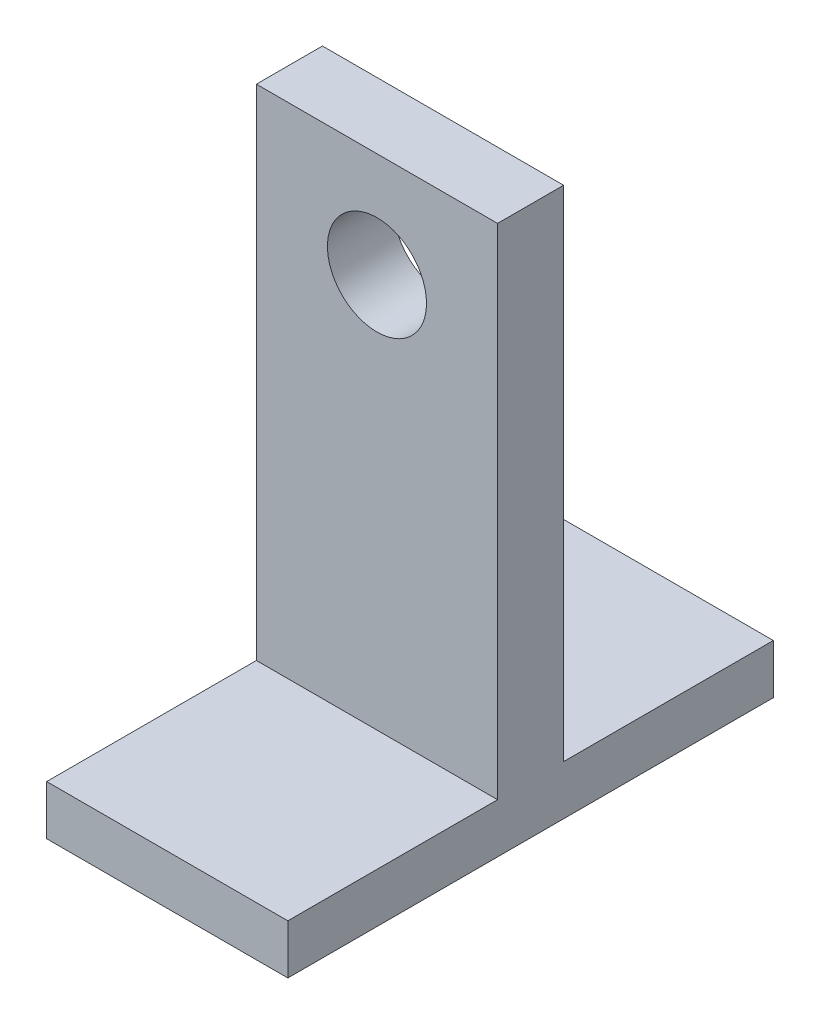
from build123d import *

# Parameters (mm, degrees)
BOSS_EXTRUDE1_DEPTH = 3.65125
SKETCH3_R           = 1.5
CUT_EXTRUDE1_DEPTH  = 19.94850642


with BuildPart() as part:
    # Sketch1 → Boss-Extrude1 (new, symmetric)
    with BuildSketch(Plane(origin=(0, 0, 0), x_dir=(0, 0, -1), z_dir=(1, 0, 0))):
        Polygon((-7.35, 0), (7.35, 0), (7.35, 1.5), (1, 1.5), (1, 16.613), (-1, 16.613), (-1, 1.5), (-7.35, 1.5), align=None)
    extrude(amount=BOSS_EXTRUDE1_DEPTH, both=True)

    # Sketch3 → Cut-Extrude1 (cut, through all)
    with BuildSketch(Plane.XY.offset(1)):
        with Locations((0, 13.438)):
            Circle(SKETCH3_R)
    extrude(amount=-CUT_EXTRUDE1_DEPTH, mode=Mode.SUBTRACT)


solid = part.part
